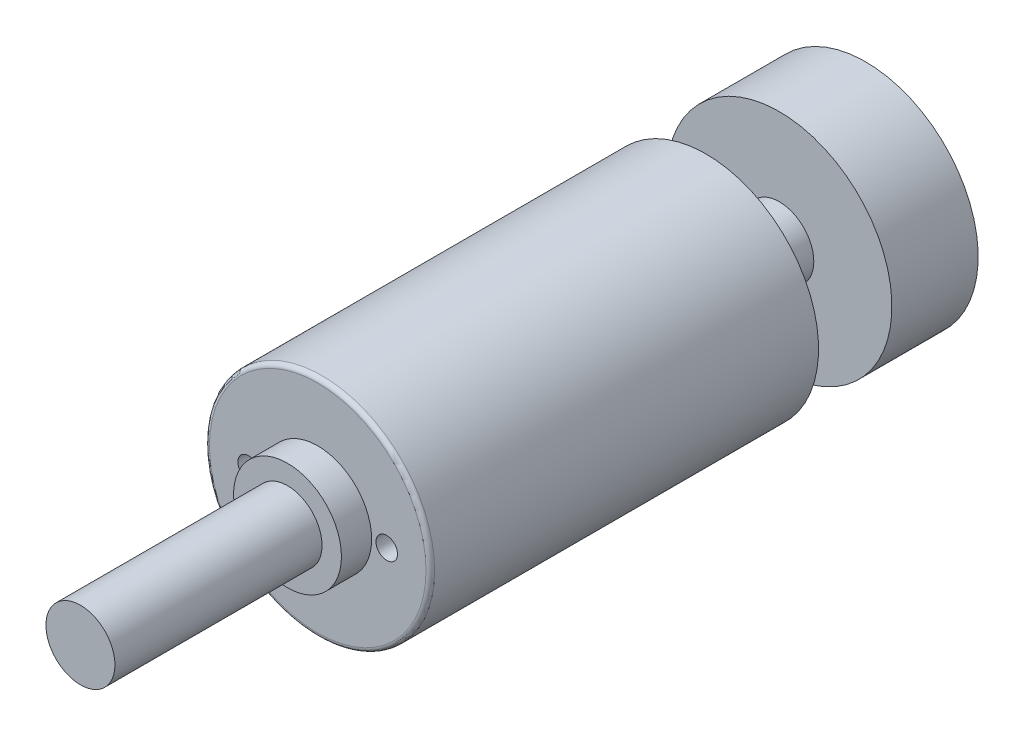
from build123d import *

# Parameters (mm, degrees)
SKETCH_1_R          = 26.1
EXTRUDE_1_DEPTH     = 90
FILLET_1_R          = 1
SKETCH_2_R          = 12.5
EXTRUDE_2_DEPTH     = 7
SKETCH_3_R          = 8
EXTRUDE_3_DEPTH     = 48
SKETCH_4_R          = 2.5
CUT_EXTRUDE_1_DEPTH = 5
SKETCH_1_2_R        = 26.1
EXTRUDE_4_DEPTH     = 10
EXTRUDE_START       = 17
SKETCH_6_R          = 8
EXTRUDE_5_DEPTH     = 17
EXTRUDE_START_2     = 20
SKETCH_7_R          = 26.1
EXTRUDE_6_DEPTH     = 20


with BuildPart() as part:
    # 草图1 → 凸台-拉伸1 (new body)
    with BuildSketch(Plane.XY):
        Circle(SKETCH_1_R)
    extrude(amount=EXTRUDE_1_DEPTH)

    # 圆角1
    fillet_1_edges = [part.edges().sort_by_distance(p)[0] for p in [
        (-26.1, 0, 90),
    ]]
    fillet(fillet_1_edges, radius=FILLET_1_R)

    # 草图2 → 凸台-拉伸2 (add)
    with BuildSketch(Plane.XY.offset(90)):
        Circle(SKETCH_2_R)
    extrude(amount=EXTRUDE_2_DEPTH)

    # 草图3 → 凸台-拉伸3 (add)
    with BuildSketch(Plane.XY.offset(97)):
        Circle(SKETCH_3_R)
    extrude(amount=EXTRUDE_3_DEPTH)

    # 草图4 → 切除-拉伸1 (cut)
    with BuildSketch(Plane.XY.offset(90)):
        with Locations((-16, 0)):
            Circle(SKETCH_4_R)
        with Locations((16, 0)):
            Circle(SKETCH_4_R)
    extrude(amount=-CUT_EXTRUDE_1_DEPTH, mode=Mode.SUBTRACT)

    # 草图1<2> → 凸台-拉伸4 (add)
    with BuildSketch(Plane.XY):
        Circle(SKETCH_1_2_R)
    extrude(amount=EXTRUDE_4_DEPTH)

    # 草图6 → 凸台-拉伸5 (add)
    with BuildSketch(Plane(origin=(0, 0, 0), x_dir=(-1, 0, 0), z_dir=(0, 0, -1)).offset(EXTRUDE_START)):
        Circle(SKETCH_6_R)
    extrude(amount=-EXTRUDE_5_DEPTH)

    # 草图7 → 凸台-拉伸6 (add)
    with BuildSketch(Plane(origin=(0, 0, -17), x_dir=(-1, 0, 0), z_dir=(0, 0, -1)).offset(EXTRUDE_START_2)):
        Circle(SKETCH_7_R)
    extrude(amount=-EXTRUDE_6_DEPTH)


solid = part.part
